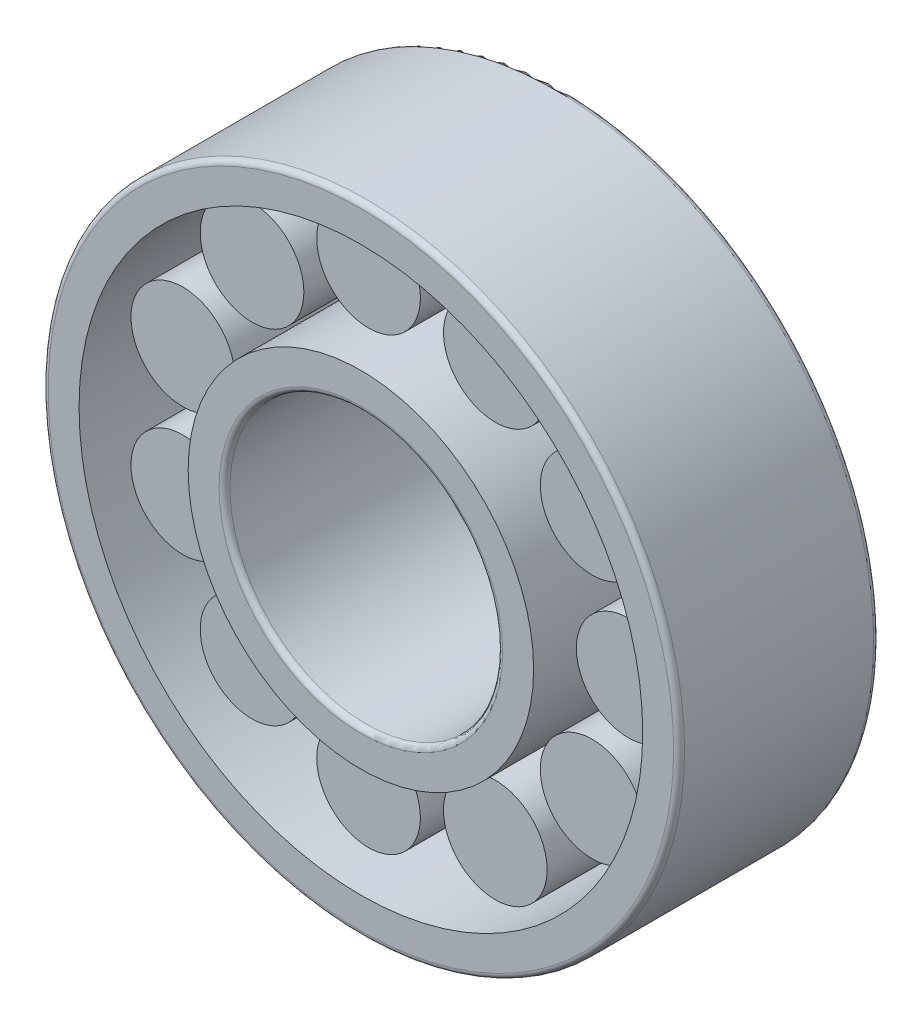
from build123d import *

# Parameters (mm, degrees)
INNERS_W             = 2
INNERS_H             = 11
OUTERS_W             = 2
OUTERS_H             = 11
ROLLERS_W            = 2.85
ROLLERS_H            = 6.6
ROLLERSPATTERN_COUNT = 11
FILLET_F1_R          = 0.3
FILLET_F2_R          = 0.3


with BuildPart() as part:
    # InnerS → InnerRing (revolve)
    with BuildSketch(Plane(origin=(0, 0, 0), x_dir=(1, 0, 0), z_dir=(0, 1, 0))):
        with Locations((8.5, 0)):
            Rectangle(INNERS_W, INNERS_H)
    revolve(axis=Axis((0, 0, 9.25), (0, 0, -1)))

    # Fillet F2
    fillet_f2_edges = [part.edges().sort_by_distance(p)[0] for p in [
        (-7.5, 0, -5.5),
        (-7.5, 0, 5.5),
    ]]
    fillet(fillet_f2_edges, radius=FILLET_F2_R)


with BuildPart() as body_2:
    # OuterS → OuterRing (revolve)
    with BuildSketch(Plane(origin=(0, 0, 0), x_dir=(1, 0, 0), z_dir=(0, 1, 0))):
        with Locations((16.5, 0)):
            Rectangle(OUTERS_W, OUTERS_H)
    revolve(axis=Axis((0, 0, 9.25), (0, 0, -1)))

    # Fillet F1
    fillet_f1_edges = [body_2.edges().sort_by_distance(p)[0] for p in [
        (-17.5, 0, -5.5),
        (-17.5, 0, 5.5),
    ]]
    fillet(fillet_f1_edges, radius=FILLET_F1_R)


with BuildPart() as body_3:
    # RollerS → Roller (revolve)
    with BuildSketch(Plane(origin=(0, 0, 0), x_dir=(1, 0, 0), z_dir=(0, 1, 0))):
        with Locations((13.925, 0)):
            Rectangle(ROLLERS_W, ROLLERS_H)
    revolve(axis=Axis((12.5, 0, -3.3), (0, 0, 1)))


with BuildPart() as rollerspattern_1:
    # RollersPattern: pattern copy
    add(body_3.part.rotate(Axis((0, 0, -6.05), (0, 0, 1)), 1 * 360 / ROLLERSPATTERN_COUNT))


with BuildPart() as rollerspattern_2:
    # RollersPattern: pattern copy
    add(body_3.part.rotate(Axis((0, 0, -6.05), (0, 0, 1)), 2 * 360 / ROLLERSPATTERN_COUNT))


with BuildPart() as rollerspattern_3:
    # RollersPattern: pattern copy
    add(body_3.part.rotate(Axis((0, 0, -6.05), (0, 0, 1)), 3 * 360 / ROLLERSPATTERN_COUNT))


with BuildPart() as rollerspattern_4:
    # RollersPattern: pattern copy
    add(body_3.part.rotate(Axis((0, 0, -6.05), (0, 0, 1)), 4 * 360 / ROLLERSPATTERN_COUNT))


with BuildPart() as rollerspattern_5:
    # RollersPattern: pattern copy
    add(body_3.part.rotate(Axis((0, 0, -6.05), (0, 0, 1)), 5 * 360 / ROLLERSPATTERN_COUNT))


with BuildPart() as rollerspattern_6:
    # RollersPattern: pattern copy
    add(body_3.part.rotate(Axis((0, 0, -6.05), (0, 0, 1)), 6 * 360 / ROLLERSPATTERN_COUNT))


with BuildPart() as rollerspattern_7:
    # RollersPattern: pattern copy
    add(body_3.part.rotate(Axis((0, 0, -6.05), (0, 0, 1)), 7 * 360 / ROLLERSPATTERN_COUNT))


with BuildPart() as rollerspattern_8:
    # RollersPattern: pattern copy
    add(body_3.part.rotate(Axis((0, 0, -6.05), (0, 0, 1)), 8 * 360 / ROLLERSPATTERN_COUNT))


with BuildPart() as rollerspattern_9:
    # RollersPattern: pattern copy
    add(body_3.part.rotate(Axis((0, 0, -6.05), (0, 0, 1)), 9 * 360 / ROLLERSPATTERN_COUNT))


with BuildPart() as rollerspattern_10:
    # RollersPattern: pattern copy
    add(body_3.part.rotate(Axis((0, 0, -6.05), (0, 0, 1)), 10 * 360 / ROLLERSPATTERN_COUNT))


solid = Compound([part.part, body_2.part, body_3.part, rollerspattern_1.part, rollerspattern_2.part, rollerspattern_3.part, rollerspattern_4.part, rollerspattern_5.part, rollerspattern_6.part, rollerspattern_7.part, rollerspattern_8.part, rollerspattern_9.part, rollerspattern_10.part])
